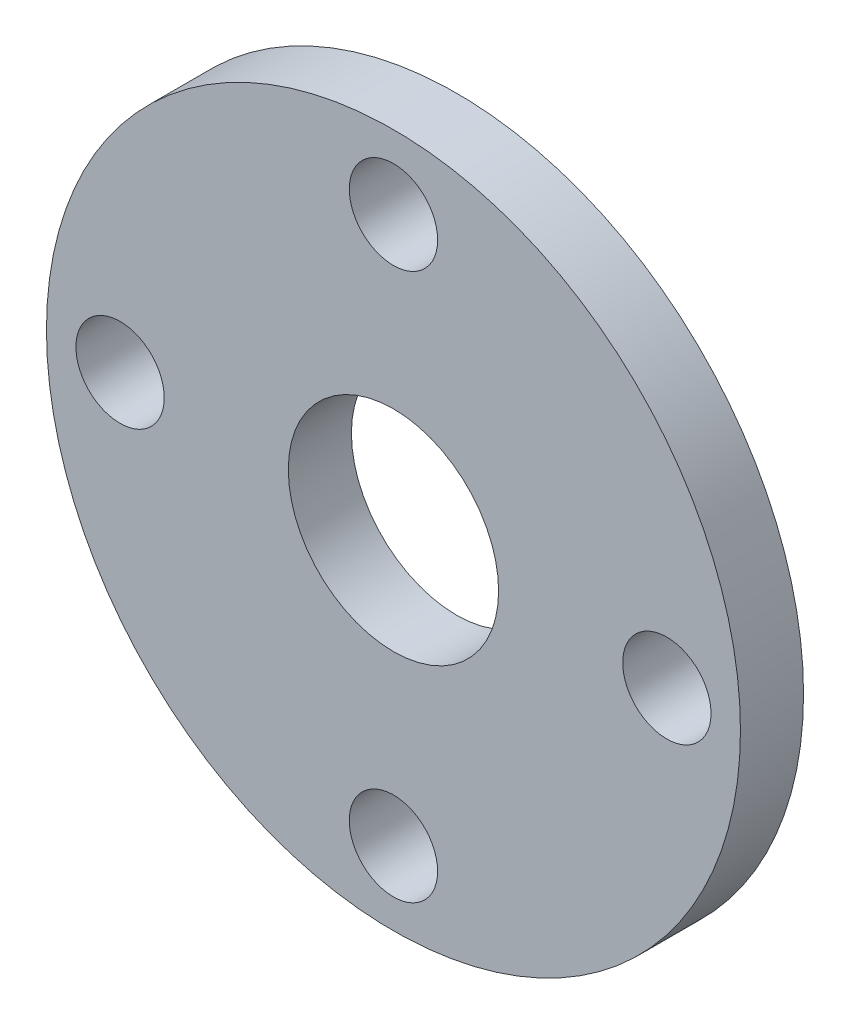
from build123d import *

# Parameters (mm, degrees)
SKETCH_1_R      = 16.5
SKETCH_1_R_2    = 2.1
SKETCH_1_R_3    = 5
EXTRUDE_1_DEPTH = 3


with BuildPart() as part:
    # 草图1 → 凸台-拉伸1 (new body)
    with BuildSketch(Plane.XY):
        Circle(SKETCH_1_R)
        with Locations((0, 13)):
            Circle(SKETCH_1_R_2, mode=Mode.SUBTRACT)
        with Locations((13, 0)):
            Circle(SKETCH_1_R_2, mode=Mode.SUBTRACT)
        with Locations((0, -13)):
            Circle(SKETCH_1_R_2, mode=Mode.SUBTRACT)
        with Locations((-13, 0)):
            Circle(SKETCH_1_R_2, mode=Mode.SUBTRACT)
        Circle(SKETCH_1_R_3, mode=Mode.SUBTRACT)
    extrude(amount=EXTRUDE_1_DEPTH)


solid = part.part
